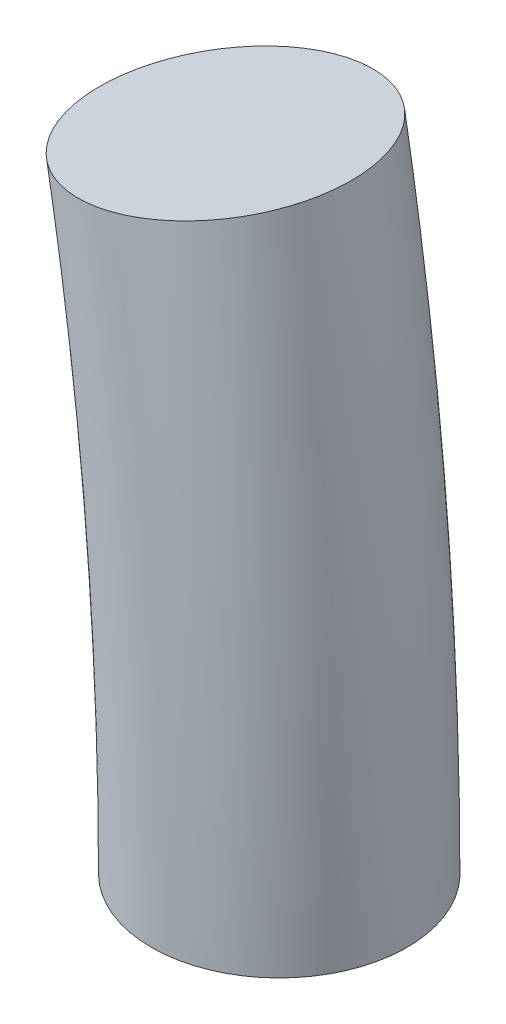
from build123d import *

# Parameters (mm, degrees)
SKETCH12_R = 1.5


with BuildPart() as part:
    # RoundBeltSweep: sweep along a path in Sketch2<2>
    with BuildLine(Plane.XY) as roundbeltsweep_path:
        ThreePointArc((40, 0), (39.847787924, 3.48622971), (39.39231012, 6.945927107))
    # Sketch12 → RoundBeltSweep (sweep)
    with BuildSketch(Plane(origin=(0, 0, 0), x_dir=(0, 0, -1), z_dir=(0, 1, 0))):
        with Locations((0, -41.5)):
            Circle(SKETCH12_R)
    sweep(path=roundbeltsweep_path.line)


solid = part.part
